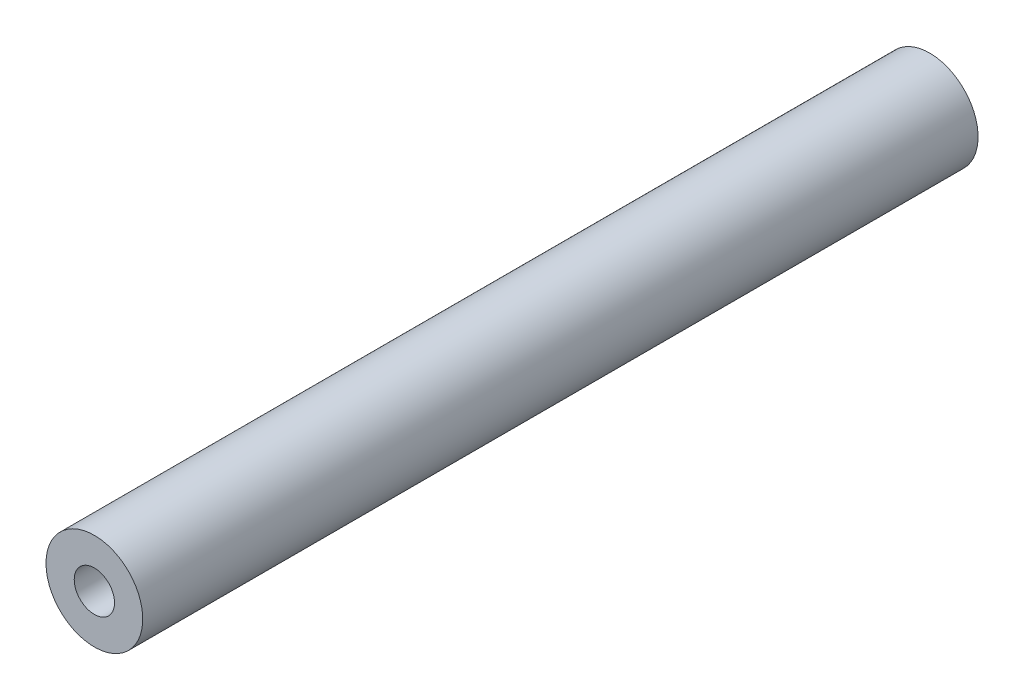
from build123d import *

# Parameters (mm, degrees)
ESBO_O1_R                = 3
ESBO_O1_R_2              = 1.25
RESSALTO_EXTRUS_O1_DEPTH = 51.8


with BuildPart() as part:
    # Esboço1 → Ressalto-extrusão1 (new body)
    with BuildSketch(Plane.XY):
        with Locations(Location((0, 0, 0), (0, 0, 180))):
            Circle(ESBO_O1_R)
        with Locations(Location((0, 0, 0), (0, 0, 180))):
            Circle(ESBO_O1_R_2, mode=Mode.SUBTRACT)
    extrude(amount=RESSALTO_EXTRUS_O1_DEPTH)


solid = part.part
